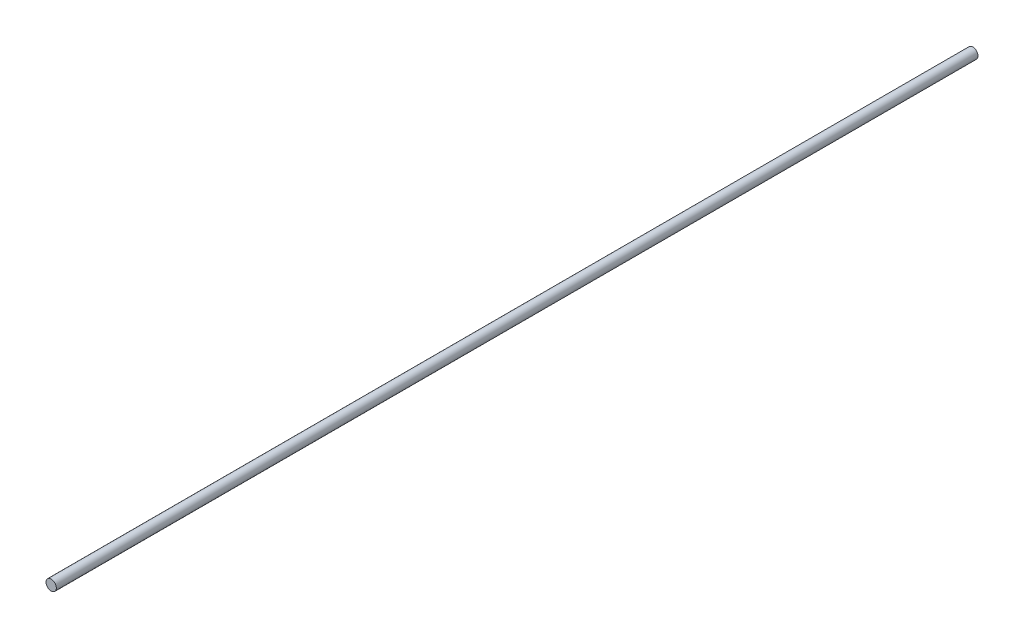
from build123d import *

# Parameters (mm, degrees)
SKETCH1_R           = 1
BOSS_EXTRUDE1_DEPTH = 177.8


with BuildPart() as part:
    # Sketch1 → Boss-Extrude1 (new body)
    with BuildSketch(Plane.XY):
        Circle(SKETCH1_R)
    extrude(amount=-BOSS_EXTRUDE1_DEPTH)


solid = part.part
